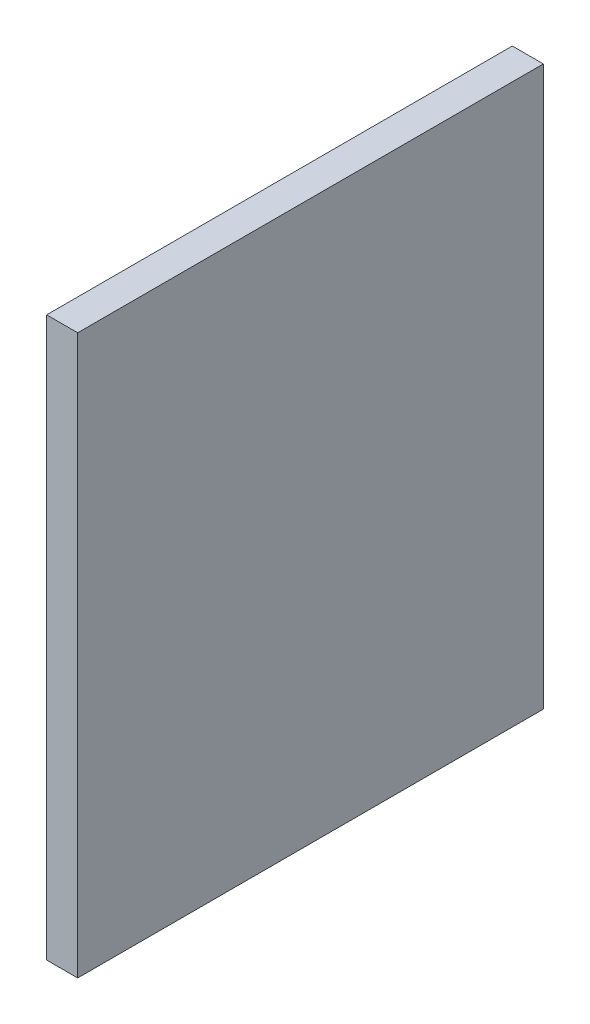
from build123d import *

# Parameters (mm, degrees)
SKETCH1_W           = 30
SKETCH1_H           = 36
BOSS_EXTRUDE1_DEPTH = 2


with BuildPart() as part:
    # Sketch1 → Boss-Extrude1 (new body)
    with BuildSketch(Plane(origin=(0, 0, 0), x_dir=(0, 0, -1), z_dir=(1, 0, 0))):
        Rectangle(SKETCH1_W, SKETCH1_H)
    extrude(amount=BOSS_EXTRUDE1_DEPTH)


solid = part.part
